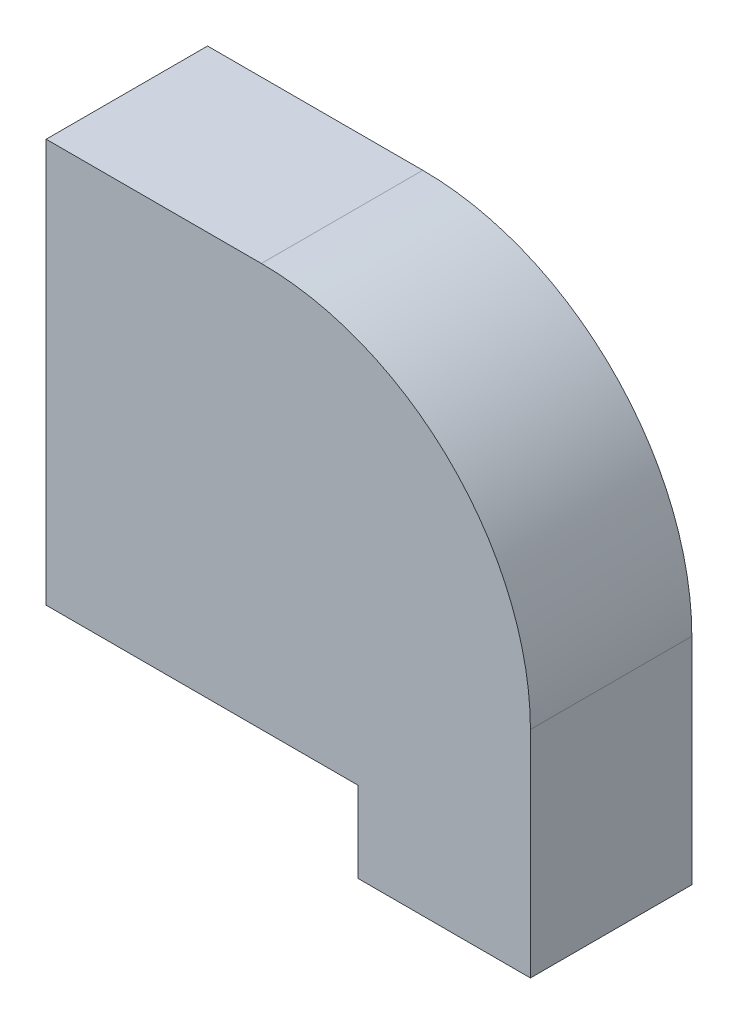
from build123d import *

# Parameters (mm, degrees)
BOSS_EXTRUDE1_DEPTH = 19.05


with BuildPart() as part:
    # Sketch1 → Boss-Extrude1 (new body)
    with BuildSketch(Plane.XY):
        with BuildLine():
            Line((0, 57.15), (0, 9.525))
            Line((0, 9.525), (36.83, 9.525))
            Line((36.83, 9.525), (36.83, 0))
            Line((36.83, 0), (57.15, 0))
            Line((57.15, 0), (57.15, 25.4))
            ThreePointArc((57.15, 25.4), (47.850640303, 47.850640303), (25.4, 57.15))
            Line((25.4, 57.15), (0, 57.15))
        make_face()
    extrude(amount=BOSS_EXTRUDE1_DEPTH)


solid = part.part
